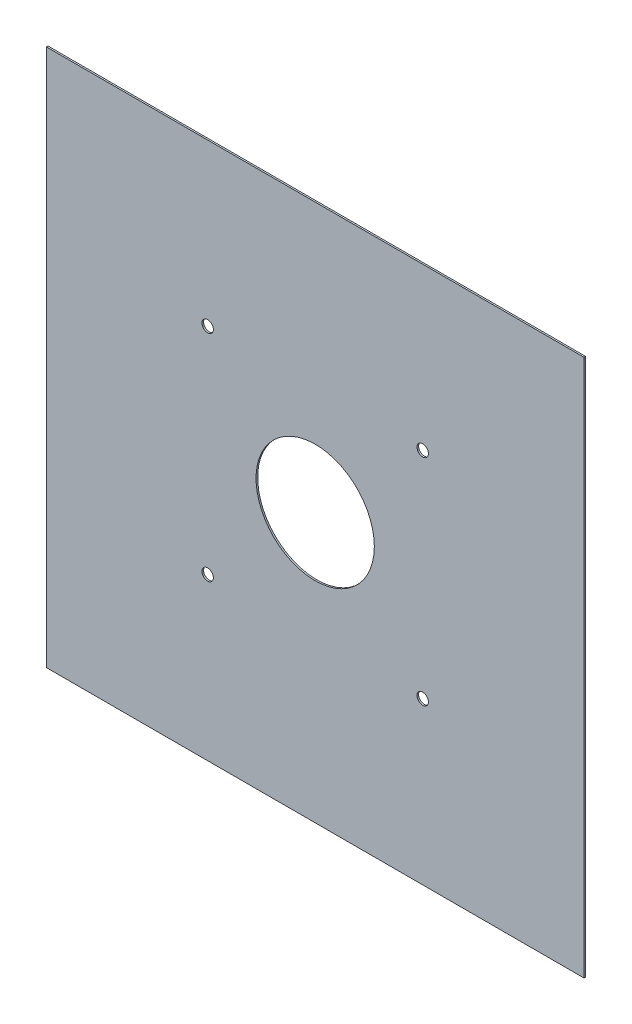
from build123d import *

# Parameters (mm, degrees)
SKETCH1_W           = 400
SKETCH1_H           = 400
BOSS_EXTRUDE1_DEPTH = 1.2
SKETCH2_R           = 44
SKETCH2_R_2         = 4.25
CUT_EXTRUDE1_DEPTH  = 539.820832931


with BuildPart() as part:
    # Sketch1 → Boss-Extrude1 (new body)
    with BuildSketch(Plane.XY):
        with Locations((-187.3, 174.6)):
            Rectangle(SKETCH1_W, SKETCH1_H)
    extrude(amount=BOSS_EXTRUDE1_DEPTH)

    # Sketch2 → Cut-Extrude1 (cut, through all)
    with BuildSketch(Plane.XY.offset(1.2)):
        with Locations((-187.3, 174.6)):
            Circle(SKETCH2_R)
        with Locations((-267.3, 254.6)):
            Circle(SKETCH2_R_2)
        with Locations((-267.3, 94.6)):
            Circle(SKETCH2_R_2)
        with Locations((-107.3, 94.6)):
            Circle(SKETCH2_R_2)
        with Locations((-107.3, 254.6)):
            Circle(SKETCH2_R_2)
    extrude(amount=-CUT_EXTRUDE1_DEPTH, mode=Mode.SUBTRACT)


solid = part.part
